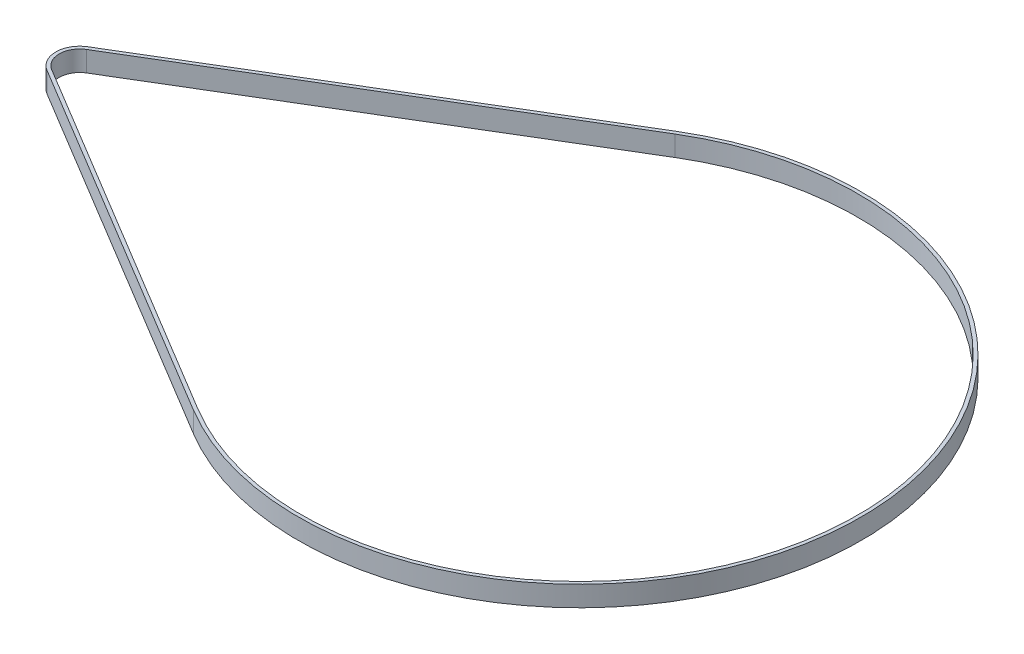
from build123d import *

# Parameters (mm, degrees)
BOSS_EXTRUDE1_DEPTH = 6


with BuildPart() as part:
    # Sketch1 → Boss-Extrude1 (new body)
    with BuildSketch(Plane(origin=(0, 0, 0), x_dir=(1, 0, 0), z_dir=(0, 1, 0))):
        with BuildLine():
            Line((-77.141306584, 5.998428265), (30.850789941, 70.957671067))
            ThreePointArc((30.850789941, 70.957671067), (156.338782074, 0), (30.850789941, -70.957671067))
            Line((30.850789941, -70.957671067), (-77.141306584, -5.998428265))
            ThreePointArc((-77.141306584, -5.998428265), (-80.533141074, 0), (-77.141306584, 5.998428265))
        make_face()
        with BuildLine():
            Line((-76.625854368, 5.141509941), (31.366242156, 70.100752743))
            ThreePointArc((31.366242156, 70.100752743), (155.338782074, 0), (31.366242156, -70.100752743))
            Line((31.366242156, -70.100752743), (-76.625854368, -5.141509941))
            ThreePointArc((-76.625854368, -5.141509941), (-79.533141074, 0), (-76.625854368, 5.141509941))
        make_face(mode=Mode.SUBTRACT)
    extrude(amount=BOSS_EXTRUDE1_DEPTH)


solid = part.part
